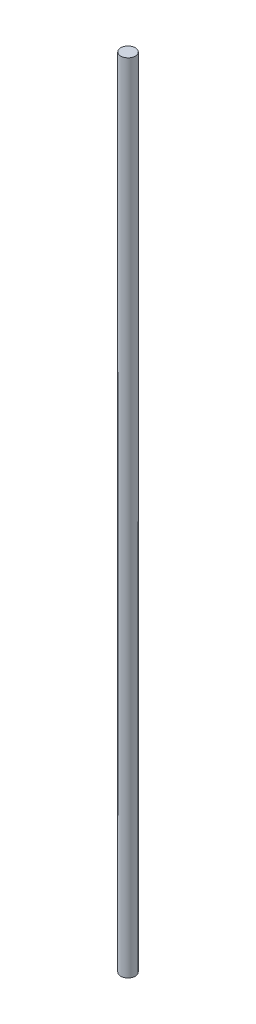
from build123d import *

# Parameters (mm, degrees)
SKETCH1_R           = 4
BOSS_EXTRUDE1_DEPTH = 439.1


with BuildPart() as part:
    # Sketch1 → Boss-Extrude1 (new body)
    with BuildSketch(Plane(origin=(0, 0, 0), x_dir=(1, 0, 0), z_dir=(0, 1, 0))):
        with Locations(Location((0, 0, 0), (0, 0, 90))):
            Circle(SKETCH1_R)
    extrude(amount=BOSS_EXTRUDE1_DEPTH)


solid = part.part
